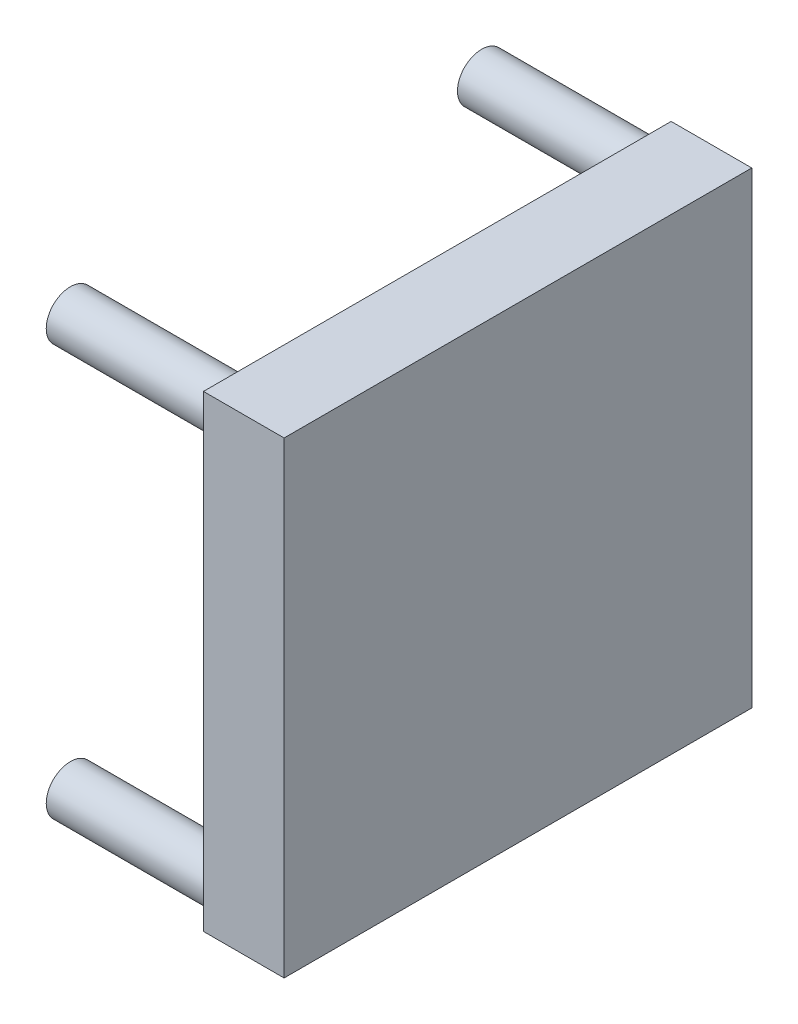
from build123d import *

# Parameters (mm, degrees)
SKETCH1_W           = 29
SKETCH1_H           = 29
BOSS_EXTRUDE1_DEPTH = 5
SKETCH2_R           = 1.5
BOSS_EXTRUDE2_DEPTH = 10


with BuildPart() as part:
    # Sketch1 → Boss-Extrude1 (new body)
    with BuildSketch(Plane(origin=(0, 0, 0), x_dir=(0, 0, -1), z_dir=(1, 0, 0))):
        Rectangle(SKETCH1_W, SKETCH1_H)
    extrude(amount=BOSS_EXTRUDE1_DEPTH)

    # Sketch2 → Boss-Extrude2 (add)
    with BuildSketch(Plane.ZY):
        with Locations((-12.75, 12.75)):
            Circle(SKETCH2_R)
        with Locations((12.75, 12.75)):
            Circle(SKETCH2_R)
        with Locations((12.75, -12.75)):
            Circle(SKETCH2_R)
        with Locations((-12.75, -12.75)):
            Circle(SKETCH2_R)
    extrude(amount=BOSS_EXTRUDE2_DEPTH)


solid = part.part
